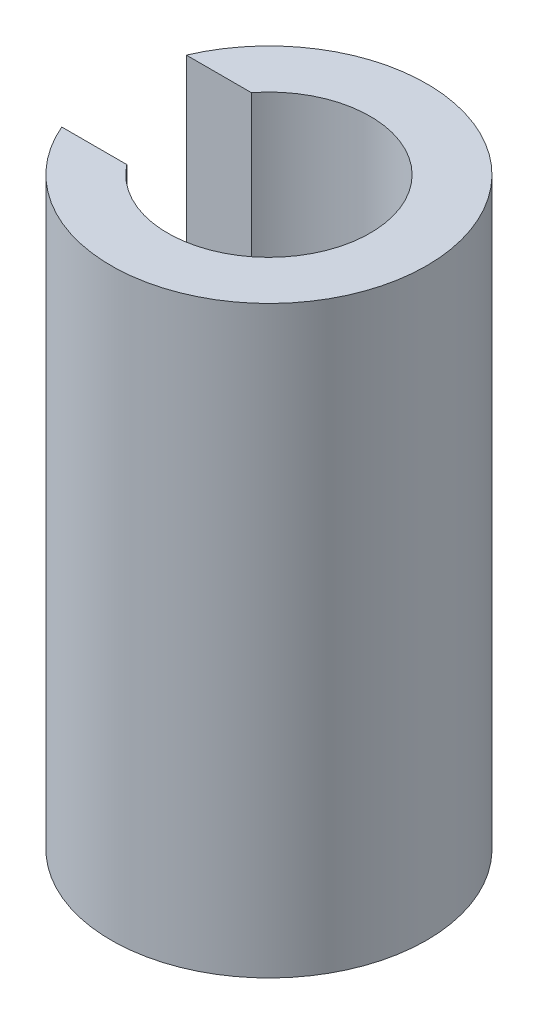
from build123d import *

# Parameters (mm, degrees)
SKETCH_1_R          = 4.05
SKETCH_1_R_2        = 2.6
EXTRUDE_1_DEPTH     = 15
SKETCH_2_W          = 2
SKETCH_2_H          = 3.198437118
CUT_EXTRUDE_1_DEPTH = 15


with BuildPart() as part:
    # 草圖1 → 填料-伸長1 (new body)
    with BuildSketch(Plane(origin=(0, 0, 0), x_dir=(1, 0, 0), z_dir=(0, 1, 0))):
        Circle(SKETCH_1_R)
        Circle(SKETCH_1_R_2, mode=Mode.SUBTRACT)
    extrude(amount=EXTRUDE_1_DEPTH)

    # 草圖2 → 除料-伸長1 (cut)
    with BuildSketch(Plane(origin=(0, 15, 0), x_dir=(1, 0, 0), z_dir=(0, 1, 0))):
        with Locations((-3.05, 0)):
            Rectangle(SKETCH_2_W, SKETCH_2_H)
    extrude(amount=-CUT_EXTRUDE_1_DEPTH, mode=Mode.SUBTRACT)


solid = part.part
